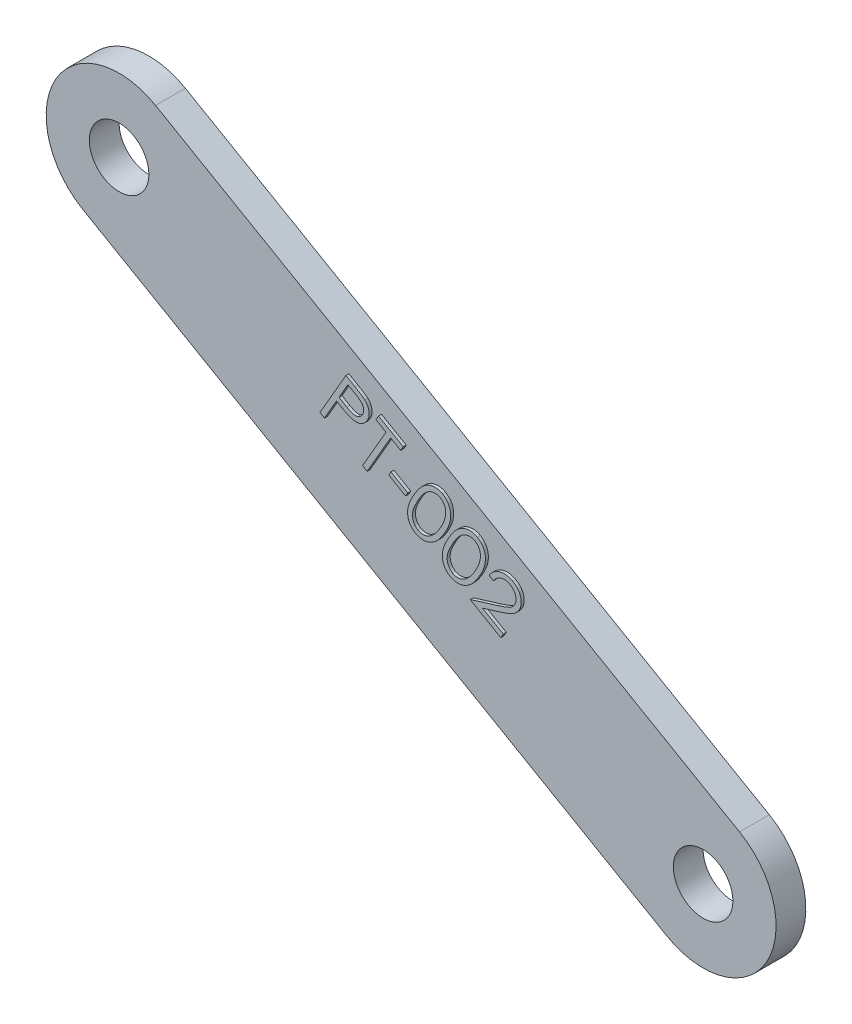
from build123d import *

# Parameters (mm, degrees)
SCHIZZO1_R                   = 2
ESTRUSIONE_ESTRUSIONE1_DEPTH = 2
ESTRUSIONE_ESTRUSIONE2_DEPTH = 0.2


with BuildPart() as part:
    # Schizzo1 → Estrusione-Estrusione1 (new body)
    with BuildSketch(Plane.XY):
        with BuildLine():
            ThreePointArc((2.45, 49.543524479), (1.268213321, 50.033036549), (0, 50.2))
            ThreePointArc((0, 50.2), (-4.733036549, 46.568213321), (-2.45, 41.056475521))
            Line((-2.45, 41.056475521), (36.780950791, 18.406475521))
            ThreePointArc((36.780950791, 18.406475521), (43.47447527, 20.2), (41.680950791, 26.893524479))
            Line((41.680950791, 26.893524479), (2.45, 49.543524479))
        make_face()
        with Locations((0, 45.3)):
            Circle(SCHIZZO1_R, mode=Mode.SUBTRACT)
        with Locations((39.230950791, 22.65)):
            Circle(SCHIZZO1_R, mode=Mode.SUBTRACT)
    extrude(amount=ESTRUSIONE_ESTRUSIONE1_DEPTH)

    # Schizzo2 → Estrusione-Estrusione2 (add)
    # profile 1 of 6: a face of its own
    with BuildSketch(Plane.XY.offset(2)):
        with BuildLine():
            Line((15.436823582, 40.427423878), (16.040489448, 40.078966346))
            add(Edge.make_bspline(
                [(16.040489448, 40.078966346), (16.081905384, 40.05474543), (16.161241142, 40.008348199), (16.274050727, 39.94058209), (16.375164414, 39.877319606), (16.46517976, 39.819277049), (16.543906901, 39.765481298), (16.610747125, 39.715805156), (16.667163997, 39.6719794), (16.699017142, 39.642370364), (16.713566371, 39.628846154)],
                knots=[0, 0, 0, 0, 1.419550858, 2.71927069, 3.893479774, 4.948362333, 5.888186574, 6.713829002, 7.41252909, 8, 8, 8, 8], degree=3))
            add(Edge.make_bspline(
                [(16.713566371, 39.628846154), (16.731338808, 39.610847327), (16.766481454, 39.575257024), (16.814451824, 39.518344976), (16.856529198, 39.45832104), (16.893962861, 39.396283411), (16.924735952, 39.33099672), (16.951040398, 39.263658567), (16.970967479, 39.193354006), (16.986733635, 39.121324752), (16.995878171, 39.047880688), (16.997978328, 38.9736989), (16.993082517, 38.899515857), (16.981005192, 38.82511813), (16.961622967, 38.75072493), (16.936852543, 38.675566486), (16.903327981, 38.600770404), (16.87657813, 38.552206554), (16.862905313, 38.527383814)],
                knots=[0, 0, 0, 0, 1.007282704, 1.99176853, 2.960281467, 3.924535213, 4.873845404, 5.831561761, 6.800790194, 7.781218813, 8.766100643, 9.743918498, 10.732795451, 11.722942189, 12.74117673, 13.792076733, 14.871450545, 16, 16, 16, 16], degree=3))
            add(Edge.make_bspline(
                [(16.862905313, 38.527383814), (16.848110979, 38.502816316), (16.819250385, 38.454890363), (16.770118664, 38.388767921), (16.719184578, 38.327998185), (16.664286664, 38.273742603), (16.606066604, 38.226197557), (16.545151324, 38.184369806), (16.481435921, 38.148110318), (16.413765389, 38.120012436), (16.344626124, 38.096310357), (16.273286065, 38.080639963), (16.200919727, 38.069804211), (16.126994373, 38.065640712), (16.051772384, 38.068081446), (15.974803768, 38.075511124), (15.89659836, 38.090443412), (15.8445592, 38.104505113), (15.818233839, 38.11161859)],
                knots=[0, 0, 0, 0, 1.123631955, 2.191966508, 3.225476362, 4.229656125, 5.212716019, 6.168237138, 7.123977852, 8.080377046, 9.036469006, 9.985511344, 10.939141864, 11.902711092, 12.883420034, 13.88713994, 14.931154855, 16, 16, 16, 16], degree=3))
            add(Edge.make_bspline(
                [(15.818233839, 38.11161859), (15.796877739, 38.118377359), (15.750109069, 38.13317869), (15.676088542, 38.163171987), (15.591960473, 38.201429938), (15.497313518, 38.247080695), (15.392216113, 38.300543726), (15.276521684, 38.361360831), (15.150918904, 38.431062822), (15.064222786, 38.480984838), (15.018954993, 38.507051282)],
                knots=[0, 0, 0, 0, 0.601675917, 1.317636826, 2.14394381, 3.084805548, 4.140714863, 5.312019369, 6.596489035, 8, 8, 8, 8], degree=3))
            Line((15.018954993, 38.507051282), (14.80300948, 38.63114984))
            Line((14.80300948, 38.63114984), (13.989708198, 37.222596154))
            Line((13.989708198, 37.222596154), (13.686823582, 37.397876603))
            Line((13.686823582, 37.397876603), (15.436823582, 40.427423878))
        make_face()
        with BuildLine():
            Line((15.569335602, 39.957672276), (14.974784319, 38.927724359))
            Line((14.974784319, 38.927724359), (15.483097621, 38.625540865))
            add(Edge.make_bspline(
                [(15.483097621, 38.625540865), (15.508219538, 38.611066963), (15.556622622, 38.583179701), (15.628583866, 38.546329422), (15.695618995, 38.512966359), (15.758968591, 38.485163143), (15.817510608, 38.460689185), (15.872555969, 38.442765813), (15.92293776, 38.428223577), (15.984319224, 38.41622366), (16.057568239, 38.409886683), (16.143136513, 38.417436876), (16.22592362, 38.436762143), (16.30446408, 38.470445593), (16.378312978, 38.514230866), (16.444309285, 38.569510515), (16.503080335, 38.633934168), (16.534318934, 38.683213007), (16.550204993, 38.708273237)],
                knots=[0, 0, 0, 0, 1.140157838, 2.196773257, 3.179299889, 4.084619846, 4.91761159, 5.673381461, 6.36027421, 6.978611614, 8.131299035, 9.238178238, 10.344026419, 11.46052043, 12.586096834, 13.708892269, 14.834881473, 16, 16, 16, 16], degree=3))
            add(Edge.make_bspline(
                [(16.550204993, 38.708273237), (16.563619828, 38.733627844), (16.590259654, 38.783978244), (16.61596502, 38.865289247), (16.629407103, 38.949157787), (16.630681581, 39.034147401), (16.620452661, 39.118024713), (16.598043014, 39.198118521), (16.562934401, 39.272720789), (16.524157228, 39.33093684), (16.48491035, 39.375117074), (16.449667974, 39.410629129), (16.407400401, 39.446462325), (16.359591521, 39.48483972), (16.304549208, 39.523612206), (16.243961051, 39.565170455), (16.17633976, 39.607067604), (16.128894801, 39.634798453), (16.104291531, 39.649178686)],
                knots=[0, 0, 0, 0, 1.15720198, 2.298027451, 3.426710911, 4.578970201, 5.721006678, 6.83008293, 7.924304722, 9.040074894, 9.642388274, 10.310143107, 11.059933964, 11.87994125, 12.786711993, 13.779400919, 14.848476199, 16, 16, 16, 16], degree=3))
            Line((16.104291531, 39.649178686), (15.569335602, 39.957672276))
        make_face(mode=Mode.SUBTRACT)
    # profile 2 of 6: a face of its own
    with BuildSketch(Plane.XY.offset(2)):
        Polygon((17.454820415, 38.86953125), (17.625193011, 39.164002404), (19.287552787, 38.204166667), (19.117180191, 37.909695513), (18.44129878, 38.299519231), (16.861671377, 35.564443109), (16.552476665, 35.743229167), (18.132104069, 38.478305288), align=None)
    # profile 3 of 6: a face of its own
    with BuildSketch(Plane.XY.offset(2)):
        Polygon((18.459232627, 36.329366987), (19.592245447, 35.674519231), (19.447113236, 35.422816506), (18.314100415, 36.077664263), align=None)
    # profile 4 of 6: a face of its own
    with BuildSketch(Plane.XY.offset(2)):
        with BuildLine():
            add(Edge.make_bspline(
                [(20.001926708, 35.770572917), (20.030442953, 35.818853454), (20.085832251, 35.912632458), (20.170296236, 36.046968855), (20.2554366, 36.16949676), (20.33852891, 36.281809404), (20.420658877, 36.383511795), (20.502458761, 36.473768057), (20.583259094, 36.553585817), (20.663583474, 36.622991792), (20.744436077, 36.682585121), (20.824246924, 36.736460634), (20.904951906, 36.782637841), (20.98586485, 36.822312996), (21.067434091, 36.85468257), (21.149698582, 36.880123302), (21.232552872, 36.898199607), (21.315492355, 36.910152224), (21.398010615, 36.916101736), (21.479556927, 36.914167491), (21.559845916, 36.907794997), (21.638466208, 36.893177349), (21.715932148, 36.873785668), (21.792180888, 36.847603558), (21.866918893, 36.814837824), (21.915003783, 36.788495458), (21.939126228, 36.775280449)],
                knots=[0, 0, 0, 0, 1.64470184, 3.194630975, 4.653089165, 6.019988628, 7.291864997, 8.485699508, 9.590908682, 10.621442252, 11.596228152, 12.535439208, 13.444367687, 14.32119253, 15.176613951, 16.015757572, 16.84405126, 17.661293493, 18.472041213, 19.267340245, 20.051811902, 20.831717748, 21.609813926, 22.392396407, 23.193523609, 24, 24, 24, 24], degree=3))
            add(Edge.make_bspline(
                [(21.939126228, 36.775280449), (21.963237649, 36.760734662), (22.010816686, 36.732031481), (22.076923537, 36.682123726), (22.13880567, 36.629012235), (22.196022856, 36.571288439), (22.247635796, 36.508788033), (22.295055269, 36.442307488), (22.337940262, 36.371749872), (22.374750917, 36.296404332), (22.407405664, 36.217975354), (22.433373091, 36.135388639), (22.452890405, 36.049304706), (22.465935256, 35.959743104), (22.474113115, 35.867026678), (22.474103798, 35.770508698), (22.469475305, 35.670538221), (22.457979081, 35.566823406), (22.440012234, 35.458911531), (22.412201037, 35.346865625), (22.37601855, 35.229972919), (22.331936013, 35.108248585), (22.27892514, 34.981847308), (22.217866958, 34.850531601), (22.14761469, 34.714574831), (22.096015728, 34.623369523), (22.069534881, 34.5765625)],
                knots=[0, 0, 0, 0, 0.819906173, 1.61791978, 2.409634102, 3.194437608, 3.982542338, 4.768526444, 5.571924858, 6.384960268, 7.209377651, 8.044911025, 8.90383789, 9.778198297, 10.680095087, 11.612946109, 12.587791853, 13.594618952, 14.651323266, 15.772652139, 16.955078826, 18.215102604, 19.542847885, 20.947176318, 22.433275512, 24, 24, 24, 24], degree=3))
            add(Edge.make_bspline(
                [(22.069534881, 34.5765625), (22.042255367, 34.530340934), (21.989273159, 34.440569519), (21.906875373, 34.312308986), (21.824367824, 34.193925467), (21.741697496, 34.085042481), (21.659010177, 33.985944556), (21.576283871, 33.896650641), (21.493588098, 33.817059981), (21.410417466, 33.747341968), (21.327147513, 33.685970664), (21.243647928, 33.631711902), (21.159634378, 33.584964162), (21.075773758, 33.544429665), (20.991400822, 33.511360956), (20.906538277, 33.485383595), (20.821456613, 33.466333913), (20.736577628, 33.454327713), (20.65216299, 33.449560706), (20.568959821, 33.450851543), (20.487134445, 33.458566224), (20.406753389, 33.472748212), (20.327673182, 33.492897477), (20.250168498, 33.519872306), (20.174070357, 33.552657691), (20.12535682, 33.579399565), (20.100784881, 33.592888622)],
                knots=[0, 0, 0, 0, 1.564353032, 3.038282716, 4.442425717, 5.769495305, 7.022013371, 8.202979506, 9.315971965, 10.365264635, 11.363980728, 12.329550134, 13.26581346, 14.164675239, 15.042616118, 15.90458025, 16.74914016, 17.581523602, 18.400388819, 19.211166561, 20.004937944, 20.793400544, 21.588136004, 22.380942137, 23.1833196, 24, 24, 24, 24], degree=3))
            add(Edge.make_bspline(
                [(20.100784881, 33.592888622), (20.077196692, 33.607280924), (20.030615458, 33.635702403), (19.964905902, 33.683893888), (19.903879934, 33.736112149), (19.848561661, 33.79353648), (19.796956523, 33.853777558), (19.750364967, 33.918660437), (19.709352665, 33.98809997), (19.672505762, 34.061210227), (19.641780528, 34.138149749), (19.617284705, 34.218658812), (19.598167728, 34.302256364), (19.585684604, 34.38948269), (19.579406454, 34.479934532), (19.579744629, 34.573607019), (19.585253904, 34.670307229), (19.59719812, 34.770839722), (19.617205364, 34.87597534), (19.645296126, 34.986786446), (19.6827327, 35.103307121), (19.729581161, 35.225373794), (19.784092912, 35.353745605), (19.848398262, 35.487778018), (19.921169504, 35.62781889), (19.9745191, 35.722124652), (20.001926708, 35.770572917)],
                knots=[0, 0, 0, 0, 0.811237059, 1.602006122, 2.390418371, 3.167030259, 3.941303087, 4.718460754, 5.50949787, 6.307590809, 7.120771023, 7.939292711, 8.776846046, 9.636878716, 10.524462242, 11.437348699, 12.386144468, 13.367764996, 14.408373516, 15.527068933, 16.723125626, 18.000457971, 19.365872786, 20.818050824, 22.365318174, 24, 24, 24, 24], degree=3))
        make_face()
        with BuildLine():
            add(Edge.make_bspline(
                [(20.284478792, 35.598798077), (20.260900488, 35.557313883), (20.215108085, 35.476745704), (20.152016, 35.357836922), (20.096660065, 35.244769576), (20.04786697, 35.138407603), (20.007287969, 35.037924809), (19.972998028, 34.943920066), (19.947117627, 34.855552144), (19.92776721, 34.772704951), (19.914879251, 34.694217253), (19.908223417, 34.618757653), (19.904800161, 34.545719813), (19.907825325, 34.474939296), (19.915448416, 34.406502681), (19.928103214, 34.340396266), (19.945517759, 34.276566709), (19.975070018, 34.196313968), (20.022301857, 34.104406789), (20.090937268, 34.006220272), (20.17339625, 33.92335889), (20.237613355, 33.881612171), (20.269755234, 33.860717147)],
                knots=[0, 0, 0, 0, 1.473578095, 2.861897281, 4.156271897, 5.361080297, 6.474850307, 7.502176081, 8.44998341, 9.316627888, 10.128238805, 10.90387962, 11.655057497, 12.384599263, 13.08918673, 13.779961076, 14.461090762, 15.130144297, 16.418063541, 17.639682087, 18.818616147, 20, 20, 20, 20], degree=3))
            add(Edge.make_bspline(
                [(20.269755234, 33.860717147), (20.303796372, 33.84301619), (20.371884362, 33.807611303), (20.484588473, 33.778469284), (20.602547464, 33.766344316), (20.704064428, 33.77207045), (20.786965874, 33.785216769), (20.849513245, 33.80283262), (20.91224994, 33.824044319), (20.97406985, 33.852724591), (21.035929898, 33.886410292), (21.097634597, 33.925940544), (21.159476471, 33.970578993), (21.198963845, 34.004167791), (21.219074144, 34.021274038)],
                knots=[0, 0, 0, 0, 1.336317718, 2.672859766, 4.034879918, 5.465161496, 6.209896974, 6.962286483, 7.731532589, 8.520531379, 9.338713029, 10.190094845, 11.078243727, 12, 12, 12, 12], degree=3))
            add(Edge.make_bspline(
                [(21.219074144, 34.021274038), (21.244079493, 34.04346035), (21.295048706, 34.088683428), (21.368458624, 34.162492313), (21.440744727, 34.242521209), (21.51135787, 34.328833777), (21.580922234, 34.42107516), (21.649659915, 34.519150507), (21.716999017, 34.623850837), (21.760100377, 34.696549487), (21.782074946, 34.733613782)],
                knots=[0, 0, 0, 0, 0.879389136, 1.792487366, 2.737233681, 3.715891339, 4.725584132, 5.776418756, 6.866341111, 8, 8, 8, 8], degree=3))
            add(Edge.make_bspline(
                [(21.782074946, 34.733613782), (21.803323461, 34.771122384), (21.844719255, 34.844195648), (21.901801276, 34.95326131), (21.952527309, 35.059118298), (21.996270295, 35.162074434), (22.035509647, 35.26113813), (22.067649878, 35.357126924), (22.093936027, 35.449728615), (22.113273125, 35.539062416), (22.128468683, 35.624829455), (22.13761332, 35.707268448), (22.141128734, 35.786433434), (22.139825939, 35.86184336), (22.133802744, 35.933860173), (22.121799347, 36.002358506), (22.104444677, 36.067374208), (22.074523353, 36.147825555), (22.028781637, 36.240025728), (21.958900358, 36.336509119), (21.878321274, 36.419469529), (21.814510267, 36.460436024), (21.782776067, 36.480809295)],
                knots=[0, 0, 0, 0, 1.331165438, 2.593341206, 3.800657749, 4.954886232, 6.047164075, 7.090143486, 8.079508509, 9.01808316, 9.911509469, 10.76827152, 11.577383924, 12.356956774, 13.095953839, 13.806675555, 14.501687137, 15.170694506, 16.455264983, 17.665059622, 18.838798079, 20, 20, 20, 20], degree=3))
            add(Edge.make_bspline(
                [(21.782776067, 36.480809295), (21.748491738, 36.498478984), (21.680105734, 36.533724223), (21.566851065, 36.563407478), (21.447794848, 36.574425298), (21.345218118, 36.56799063), (21.261375866, 36.554894396), (21.198283164, 36.537474866), (21.135368492, 36.515787465), (21.072849692, 36.488202277), (21.010312705, 36.45513636), (20.948192571, 36.416466116), (20.885958804, 36.372996912), (20.824679128, 36.322477127), (20.762077381, 36.265006888), (20.698374561, 36.198271956), (20.633533482, 36.121428466), (20.565993792, 36.035915359), (20.497437536, 35.940328468), (20.427595841, 35.835140542), (20.355888043, 35.72053813), (20.308814678, 35.640286428), (20.284478792, 35.598798077)],
                knots=[0, 0, 0, 0, 1.187725018, 2.369122254, 3.586690291, 4.865743253, 5.531148062, 6.20316933, 6.883121918, 7.584182008, 8.310334728, 9.065167884, 9.841821717, 10.652000358, 11.514913686, 12.464034716, 13.497789948, 14.617825396, 15.827243335, 17.127906756, 18.515191441, 20, 20, 20, 20], degree=3))
        make_face(mode=Mode.SUBTRACT)
    # profile 5 of 6: a face of its own
    with BuildSketch(Plane.XY.offset(2)):
        with BuildLine():
            add(Edge.make_bspline(
                [(22.333533565, 34.424419071), (22.36204981, 34.472699608), (22.417439107, 34.566478612), (22.501903093, 34.700815009), (22.587043457, 34.823342914), (22.670135766, 34.935655558), (22.752265733, 35.037357949), (22.834065617, 35.127614211), (22.914865951, 35.207431971), (22.995190331, 35.276837946), (23.076042933, 35.336431275), (23.15585378, 35.390306788), (23.236558762, 35.436483995), (23.317471706, 35.476159149), (23.399040947, 35.508528724), (23.481305438, 35.533969456), (23.564159729, 35.55204576), (23.647099211, 35.563998378), (23.729617472, 35.56994789), (23.811163783, 35.568013645), (23.891452773, 35.561641151), (23.970073064, 35.547023503), (24.047539004, 35.527631821), (24.123787744, 35.501449712), (24.198525749, 35.468683977), (24.246610639, 35.442341612), (24.270733084, 35.429126603)],
                knots=[0, 0, 0, 0, 1.64470184, 3.194630975, 4.653089165, 6.019988628, 7.291864997, 8.485699508, 9.590908682, 10.621442252, 11.596228152, 12.535439208, 13.444367687, 14.32119253, 15.176613951, 16.015757572, 16.84405126, 17.661293493, 18.472041213, 19.267340245, 20.051811902, 20.831717748, 21.609813926, 22.392396407, 23.193523609, 24, 24, 24, 24], degree=3))
            add(Edge.make_bspline(
                [(24.270733084, 35.429126603), (24.294844506, 35.414580816), (24.342423542, 35.385877635), (24.408530393, 35.33596988), (24.470412526, 35.282858389), (24.527629712, 35.225134593), (24.579242653, 35.162634186), (24.626662125, 35.096153642), (24.669547119, 35.025596026), (24.706357774, 34.950250486), (24.739012521, 34.871821507), (24.764979947, 34.789234793), (24.784497261, 34.70315086), (24.797542112, 34.613589258), (24.805719971, 34.520872832), (24.805710654, 34.424354852), (24.801082162, 34.324384375), (24.789585937, 34.220669559), (24.771619091, 34.112757685), (24.743807893, 34.000711779), (24.707625406, 33.883819073), (24.663542869, 33.762094739), (24.610531996, 33.635693462), (24.549473814, 33.504377755), (24.479221546, 33.368420984), (24.427622585, 33.277215677), (24.401141738, 33.230408654)],
                knots=[0, 0, 0, 0, 0.819906173, 1.61791978, 2.409634102, 3.194437608, 3.982542338, 4.768526444, 5.571924858, 6.384960268, 7.209377651, 8.044911025, 8.90383789, 9.778198297, 10.680095087, 11.612946109, 12.587791853, 13.594618952, 14.651323266, 15.772652139, 16.955078826, 18.215102604, 19.542847885, 20.947176318, 22.433275512, 24, 24, 24, 24], degree=3))
            add(Edge.make_bspline(
                [(24.401141738, 33.230408654), (24.373862223, 33.184187088), (24.320880015, 33.094415673), (24.23848223, 32.96615514), (24.15597468, 32.84777162), (24.073304352, 32.738888635), (23.990617034, 32.63979071), (23.907890728, 32.550496795), (23.825194955, 32.470906135), (23.742024322, 32.401188121), (23.658754369, 32.339816818), (23.575254785, 32.285558056), (23.491241234, 32.238810316), (23.407380614, 32.198275819), (23.323007678, 32.16520711), (23.238145134, 32.139229749), (23.153063469, 32.120180067), (23.068184485, 32.108173867), (22.983769847, 32.10340686), (22.900566678, 32.104697697), (22.818741301, 32.112412378), (22.738360246, 32.126594366), (22.659280038, 32.146743631), (22.581775354, 32.17371846), (22.505677214, 32.206503845), (22.456963677, 32.233245718), (22.432391738, 32.246734776)],
                knots=[0, 0, 0, 0, 1.564353032, 3.038282716, 4.442425717, 5.769495305, 7.022013371, 8.202979506, 9.315971965, 10.365264635, 11.363980728, 12.329550134, 13.26581346, 14.164675239, 15.042616118, 15.90458025, 16.74914016, 17.581523602, 18.400388819, 19.211166561, 20.004937944, 20.793400544, 21.588136004, 22.380942137, 23.1833196, 24, 24, 24, 24], degree=3))
            add(Edge.make_bspline(
                [(22.432391738, 32.246734776), (22.408803549, 32.261127078), (22.362222315, 32.289548557), (22.296512758, 32.337740042), (22.23548679, 32.389958303), (22.180168518, 32.447382634), (22.12856338, 32.507623712), (22.081971824, 32.572506591), (22.040959521, 32.641946124), (22.004112618, 32.71505638), (21.973387384, 32.791995903), (21.948891561, 32.872504966), (21.929774585, 32.956102518), (21.91729146, 33.043328844), (21.911013311, 33.133780686), (21.911351485, 33.227453173), (21.91686076, 33.324153383), (21.928804976, 33.424685876), (21.94881222, 33.529821494), (21.976902983, 33.640632599), (22.014339556, 33.757153274), (22.061188017, 33.879219948), (22.115699768, 34.007591758), (22.180005118, 34.141624172), (22.25277636, 34.281665044), (22.306125957, 34.375970806), (22.333533565, 34.424419071)],
                knots=[0, 0, 0, 0, 0.811237059, 1.602006122, 2.390418371, 3.167030259, 3.941303087, 4.718460754, 5.50949787, 6.307590809, 7.120771023, 7.939292711, 8.776846046, 9.636878716, 10.524462242, 11.437348699, 12.386144468, 13.367764996, 14.408373516, 15.527068933, 16.723125626, 18.000457971, 19.365872786, 20.818050824, 22.365318174, 24, 24, 24, 24], degree=3))
        make_face()
        with BuildLine():
            add(Edge.make_bspline(
                [(22.616085648, 34.252644231), (22.592507345, 34.211160036), (22.546714941, 34.130591858), (22.483622856, 34.011683076), (22.428266922, 33.89861573), (22.379473826, 33.792253757), (22.338894825, 33.691770963), (22.304604884, 33.59776622), (22.278724483, 33.509398297), (22.259374067, 33.426551105), (22.246486107, 33.348063407), (22.239830274, 33.272603807), (22.236407018, 33.199565967), (22.239432181, 33.12878545), (22.247055273, 33.060348835), (22.259710071, 32.99424242), (22.277124615, 32.930412863), (22.306676875, 32.850160122), (22.353908714, 32.758252943), (22.422544125, 32.660066426), (22.505003106, 32.577205044), (22.569220212, 32.535458325), (22.60136209, 32.514563301)],
                knots=[0, 0, 0, 0, 1.473578095, 2.861897281, 4.156271897, 5.361080297, 6.474850307, 7.502176081, 8.44998341, 9.316627888, 10.128238805, 10.90387962, 11.655057497, 12.384599263, 13.08918673, 13.779961076, 14.461090762, 15.130144297, 16.418063541, 17.639682087, 18.818616147, 20, 20, 20, 20], degree=3))
            add(Edge.make_bspline(
                [(22.60136209, 32.514563301), (22.635403228, 32.496862344), (22.703491219, 32.461457457), (22.81619533, 32.432315437), (22.93415432, 32.42019047), (23.035671285, 32.425916604), (23.11857273, 32.439062923), (23.181120102, 32.456678774), (23.243856797, 32.477890473), (23.305676707, 32.506570745), (23.367536754, 32.540256446), (23.429241454, 32.579786697), (23.491083327, 32.624425147), (23.530570701, 32.658013945), (23.550681001, 32.675120192)],
                knots=[0, 0, 0, 0, 1.336317718, 2.672859766, 4.034879918, 5.465161496, 6.209896974, 6.962286483, 7.731532589, 8.520531379, 9.338713029, 10.190094845, 11.078243727, 12, 12, 12, 12], degree=3))
            add(Edge.make_bspline(
                [(23.550681001, 32.675120192), (23.57568635, 32.697306504), (23.626655563, 32.742529581), (23.70006548, 32.816338467), (23.772351583, 32.896367363), (23.842964727, 32.982679931), (23.91252909, 33.074921314), (23.981266772, 33.172996661), (24.048605873, 33.277696991), (24.091707233, 33.350395641), (24.113681802, 33.387459936)],
                knots=[0, 0, 0, 0, 0.879389136, 1.792487366, 2.737233681, 3.715891339, 4.725584132, 5.776418756, 6.866341111, 8, 8, 8, 8], degree=3))
            add(Edge.make_bspline(
                [(24.113681802, 33.387459936), (24.134930317, 33.424968538), (24.176326111, 33.498041802), (24.233408132, 33.607107464), (24.284134165, 33.712964451), (24.327877151, 33.815920588), (24.367116504, 33.914984284), (24.399256734, 34.010973077), (24.425542883, 34.103574769), (24.444879981, 34.19290857), (24.46007554, 34.278675609), (24.469220176, 34.361114602), (24.47273559, 34.440279588), (24.471432796, 34.515689514), (24.4654096, 34.587706327), (24.453406203, 34.65620466), (24.436051533, 34.721220361), (24.40613021, 34.801671709), (24.360388493, 34.893871882), (24.290507215, 34.990355273), (24.20992813, 35.073315683), (24.146117123, 35.114282178), (24.114382924, 35.134655449)],
                knots=[0, 0, 0, 0, 1.331165438, 2.593341206, 3.800657749, 4.954886232, 6.047164075, 7.090143486, 8.079508509, 9.01808316, 9.911509469, 10.76827152, 11.577383924, 12.356956774, 13.095953839, 13.806675555, 14.501687137, 15.170694506, 16.455264983, 17.665059622, 18.838798079, 20, 20, 20, 20], degree=3))
            add(Edge.make_bspline(
                [(24.114382924, 35.134655449), (24.080098594, 35.152325138), (24.01171259, 35.187570377), (23.898457921, 35.217253631), (23.779401704, 35.228271452), (23.676824974, 35.221836783), (23.592982722, 35.20874055), (23.52989002, 35.19132102), (23.466975348, 35.169633619), (23.404456549, 35.142048431), (23.341919561, 35.108982514), (23.279799428, 35.07031227), (23.21756566, 35.026843066), (23.156285984, 34.976323281), (23.093684237, 34.918853042), (23.029981417, 34.85211811), (22.965140338, 34.77527462), (22.897600648, 34.689761513), (22.829044392, 34.594174621), (22.759202697, 34.488986696), (22.6874949, 34.374384283), (22.640421535, 34.294132582), (22.616085648, 34.252644231)],
                knots=[0, 0, 0, 0, 1.187725018, 2.369122254, 3.586690291, 4.865743253, 5.531148062, 6.20316933, 6.883121918, 7.584182008, 8.310334728, 9.065167884, 9.841821717, 10.652000358, 11.514913686, 12.464034716, 13.497789948, 14.617825396, 15.827243335, 17.127906756, 18.515191441, 20, 20, 20, 20], degree=3))
        make_face(mode=Mode.SUBTRACT)
    # profile 6 of 6: a face of its own
    with BuildSketch(Plane.XY.offset(2)):
        with BuildLine():
            Line((25.346630806, 33.440044071), (25.056366383, 33.607612179))
            add(Edge.make_bspline(
                [(25.056366383, 33.607612179), (25.079404179, 33.643066461), (25.12474561, 33.712845178), (25.20133377, 33.80894001), (25.283468669, 33.895138006), (25.371972078, 33.970408426), (25.46524844, 34.037153645), (25.565353318, 34.092213153), (25.670591864, 34.138435765), (25.780658025, 34.173529007), (25.892967598, 34.199132649), (26.005774513, 34.212297026), (26.11760551, 34.214792019), (26.2282624, 34.204679661), (26.337727921, 34.18352197), (26.446072283, 34.150795718), (26.554047628, 34.107761034), (26.62280399, 34.069934844), (26.657728562, 34.050721154)],
                knots=[0, 0, 0, 0, 1.095846443, 2.156770812, 3.181117826, 4.178233167, 5.165187099, 6.149905994, 7.135016387, 8.141132684, 9.140877849, 10.117282622, 11.080986486, 12.036174108, 12.992898329, 13.966874208, 14.967280337, 16, 16, 16, 16], degree=3))
            add(Edge.make_bspline(
                [(26.657728562, 34.050721154), (26.691322592, 34.030298367), (26.757129663, 33.990292336), (26.847132352, 33.921020128), (26.927626441, 33.846569671), (26.998204785, 33.766262636), (27.058862355, 33.680252635), (27.109634596, 33.588899347), (27.149825627, 33.491609114), (27.180066561, 33.390280353), (27.201364399, 33.287045162), (27.211454553, 33.18439634), (27.213622846, 33.083425638), (27.203817629, 32.984176532), (27.186116551, 32.886024277), (27.156634754, 32.790063144), (27.119207807, 32.694953987), (27.086095635, 32.634828244), (27.069287056, 32.604306891)],
                knots=[0, 0, 0, 0, 1.122850775, 2.199543206, 3.239223616, 4.252041546, 5.24896732, 6.241498366, 7.232545168, 8.250985027, 9.259565945, 10.239818902, 11.194995647, 12.140715311, 13.085184195, 14.040290885, 15.005201899, 16, 16, 16, 16], degree=3))
            add(Edge.make_bspline(
                [(27.069287056, 32.604306891), (27.043470972, 32.562883436), (26.992200078, 32.480616212), (26.896639934, 32.370865077), (26.788948173, 32.273112457), (26.686752939, 32.203289725), (26.59599555, 32.151361569), (26.516750345, 32.112379664), (26.42796514, 32.071791909), (26.328806622, 32.030442391), (26.219544112, 31.988579844), (26.099954245, 31.945980687), (25.970695665, 31.901554292), (25.880495046, 31.873502119), (25.833910453, 31.859014423)],
                knots=[0, 0, 0, 0, 1.18511296, 2.353641271, 3.524391684, 4.712823685, 5.354173304, 6.065686823, 6.859008769, 7.727499398, 8.677212082, 9.703475296, 10.813947517, 12, 12, 12, 12], degree=3))
            Line((25.833910453, 31.859014423), (24.610452921, 31.481109776))
            Line((24.610452921, 31.481109776), (26.009190902, 30.673417468))
            Line((26.009190902, 30.673417468), (25.840220549, 30.381049679))
            Line((25.840220549, 30.381049679), (23.782428081, 31.569451122))
            Line((23.782428081, 31.569451122), (25.662135613, 32.15068109))
            add(Edge.make_bspline(
                [(25.662135613, 32.15068109), (25.707734016, 32.164855676), (25.795325185, 32.192084011), (25.920974565, 32.23256851), (26.035498225, 32.271878161), (26.138804238, 32.309539853), (26.231075224, 32.34513915), (26.311972654, 32.379538445), (26.381776686, 32.412077673), (26.459518618, 32.452884673), (26.543988162, 32.508091539), (26.632329369, 32.584893997), (26.710298383, 32.670275838), (26.75097147, 32.7352017), (26.771310293, 32.767668269)],
                knots=[0, 0, 0, 0, 1.321058085, 2.537655189, 3.652024792, 4.670652223, 5.579581153, 6.387817522, 7.102239038, 7.70963491, 8.816098413, 9.884189496, 10.941976197, 12, 12, 12, 12], degree=3))
            add(Edge.make_bspline(
                [(26.771310293, 32.767668269), (26.782747762, 32.788953864), (26.805369128, 32.831053147), (26.831034813, 32.897251905), (26.850390809, 32.964555255), (26.862310714, 33.03317349), (26.866677571, 33.103035348), (26.862488605, 33.173882349), (26.853213063, 33.246086648), (26.835240927, 33.31842576), (26.812038951, 33.389544095), (26.781547567, 33.456979936), (26.745857529, 33.52067189), (26.703385094, 33.579555368), (26.655786617, 33.634809021), (26.600902215, 33.684627052), (26.54083665, 33.731190241), (26.496976158, 33.758053234), (26.474735774, 33.771674679)],
                knots=[0, 0, 0, 0, 0.995584652, 1.96909695, 2.920854463, 3.879369527, 4.835167871, 5.800056367, 6.801778624, 7.832560873, 8.868689934, 9.882392737, 10.879282462, 11.874073912, 12.871289639, 13.880631422, 14.925329581, 16, 16, 16, 16], degree=3))
            add(Edge.make_bspline(
                [(26.474735774, 33.771674679), (26.4506497, 33.784739842), (26.403432238, 33.810352312), (26.329913396, 33.840621743), (26.255987595, 33.863204237), (26.181330626, 33.878369551), (26.106069181, 33.884134967), (26.030421274, 33.883973081), (25.954558009, 33.874446508), (25.878725285, 33.857595946), (25.803896982, 33.833284474), (25.731197453, 33.800598371), (25.660595133, 33.760459773), (25.592650945, 33.711869475), (25.527193751, 33.655303537), (25.464124986, 33.591131817), (25.402567301, 33.519653366), (25.365587775, 33.46702379), (25.346630806, 33.440044071)],
                knots=[0, 0, 0, 0, 1.004459554, 1.969105966, 2.910000745, 3.836257091, 4.75666472, 5.673873704, 6.606296727, 7.554619687, 8.519608787, 9.486537489, 10.473173827, 11.493526911, 12.545051366, 13.642124959, 14.791272636, 16, 16, 16, 16], degree=3))
        make_face()
    extrude(amount=ESTRUSIONE_ESTRUSIONE2_DEPTH)


solid = part.part
